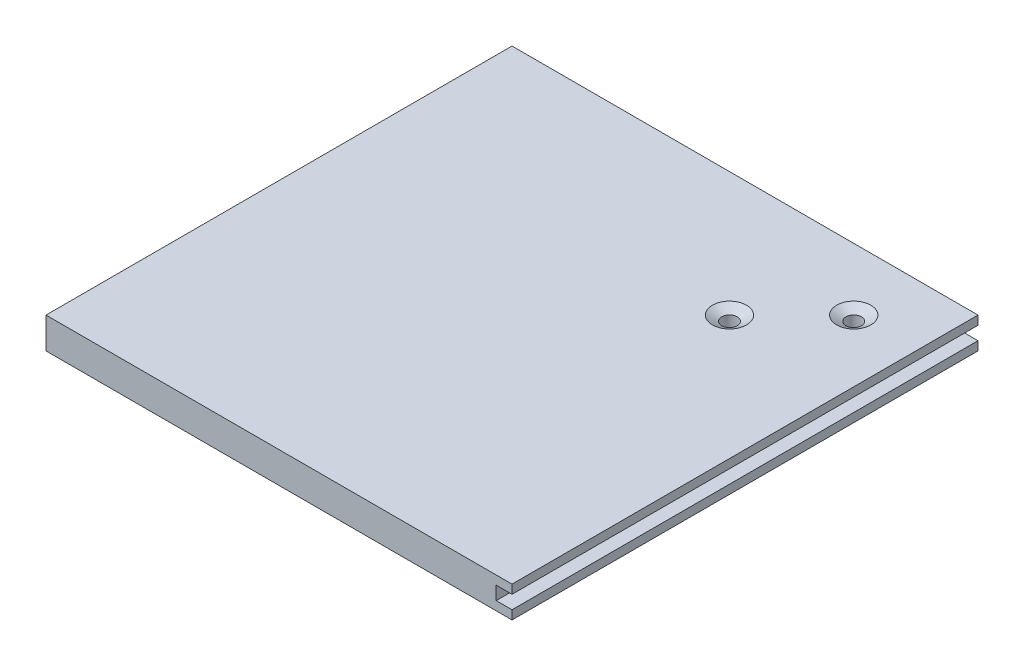
from build123d import *

# Parameters (mm, degrees)
SKETCH1_W               = 150
SKETCH1_H               = 150
BOSS_EXTRUDE1_DEPTH     = 10
CUT_EXTRUDE1_DEPTH      = 213.367605816
CUT_EXTRUDE1_DEPTH_BACK = 213.367605816
SKETCH2_W               = 5.1
SKETCH2_H               = 4.3
CUT_EXTRUDE2_DEPTH      = 209.796575642
CUT_EXTRUDE2_DEPTH_BACK = 209.796575642
SKETCH3_W               = 5
SKETCH3_H               = 4.3
CUT_EXTRUDE3_DEPTH      = 213.367605816
CUT_EXTRUDE3_DEPTH_BACK = 213.367605816
SKETCH4_R               = 2.5
CHAMFER1_SIZE           = 3
CHAMFER1_SIZE2          = 1.732050808


with BuildPart() as part:
    # Sketch1 → Boss-Extrude1 (new body)
    with BuildSketch(Plane(origin=(0, 0, 0), x_dir=(1, 0, 0), z_dir=(0, 1, 0))):
        with Locations((75, 75)):
            Rectangle(SKETCH1_W, SKETCH1_H)
    extrude(amount=BOSS_EXTRUDE1_DEPTH)

    # Sketch2 → Cut-Extrude1 (cut, two sides: drawn at the far end of the back side and taken through both)
    with BuildSketch(Plane.XY.offset(-CUT_EXTRUDE1_DEPTH_BACK)):
        with Locations((147.45, 5)):
            Rectangle(SKETCH2_W, SKETCH2_H)
    extrude(amount=CUT_EXTRUDE1_DEPTH + CUT_EXTRUDE1_DEPTH_BACK, mode=Mode.SUBTRACT)

    # Sketch3 → Cut-Extrude2 (cut, two sides: drawn at the far end of the back side and taken through both)
    with BuildSketch(Plane(origin=(144.9, 0, 0), x_dir=(0, 0, -1), z_dir=(1, 0, 0)).offset(-CUT_EXTRUDE2_DEPTH_BACK)):
        with Locations((147.5, 5)):
            Rectangle(SKETCH3_W, SKETCH3_H)
    extrude(amount=CUT_EXTRUDE2_DEPTH + CUT_EXTRUDE2_DEPTH_BACK, mode=Mode.SUBTRACT)

    # Sketch4 → Cut-Extrude3 (cut, two sides: drawn at the far end of the back side and taken through both)
    with BuildSketch(Plane(origin=(0, 10, 0), x_dir=(1, 0, 0), z_dir=(0, 1, 0)).offset(-CUT_EXTRUDE3_DEPTH_BACK)):
        with Locations(Location((130, 130, 0), (0, 0, 270))):
            Circle(SKETCH4_R)
        with Locations(Location((110, 110, 0), (0, 0, 270))):
            Circle(SKETCH4_R)
    extrude(amount=CUT_EXTRUDE3_DEPTH + CUT_EXTRUDE3_DEPTH_BACK, mode=Mode.SUBTRACT)

    # Chamfer1
    chamfer1_edges = [part.edges().sort_by_distance(p)[0] for p in [
        (130, 10, -132.5),
        (110, 10, -112.5),
    ]]
    chamfer1_side = [part.faces().sort_by_distance(p)[0] for p in [
        (74.921322866, 10, -74.921322866),
    ]]
    chamfer(chamfer1_edges, length=CHAMFER1_SIZE, length2=CHAMFER1_SIZE2, reference=chamfer1_side[0])


solid = part.part
